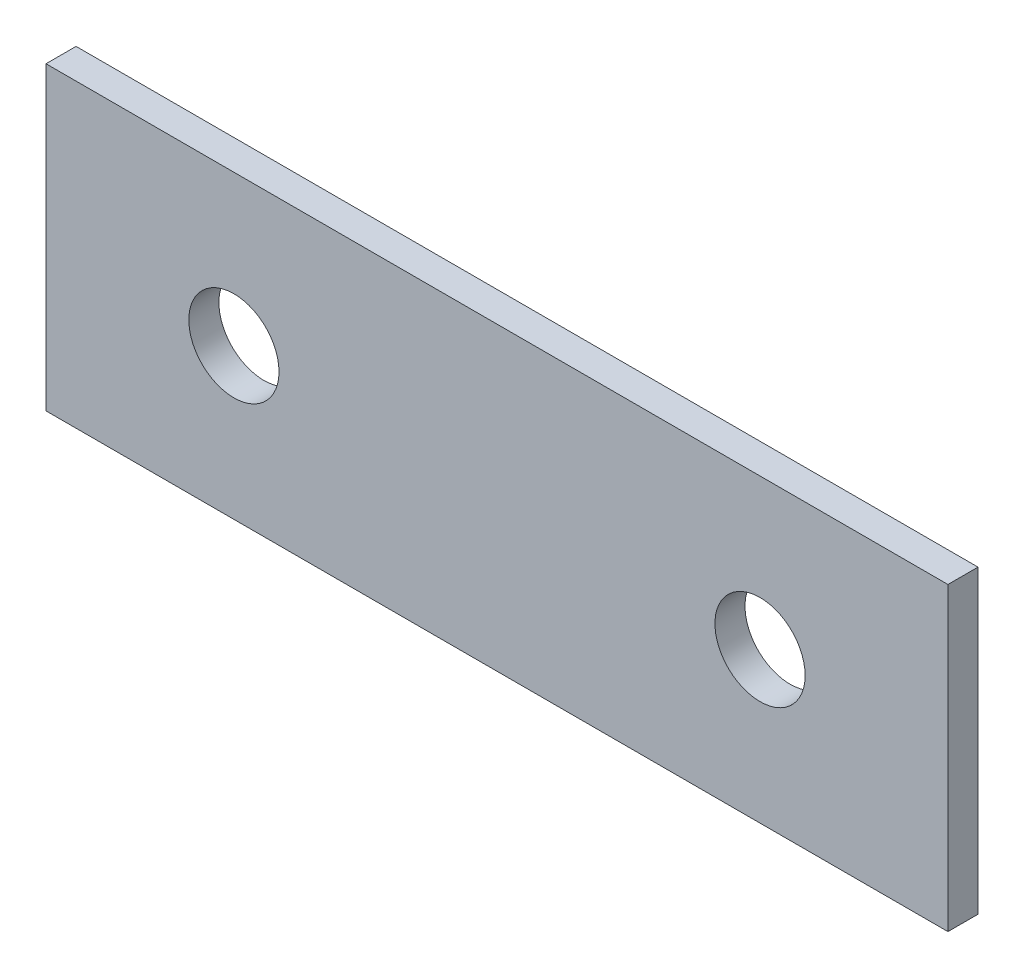
from build123d import *

# Parameters (mm, degrees)
ESBO_O1_W                = 30
ESBO_O1_H                = 10
ESBO_O1_R                = 1.5
RESSALTO_EXTRUS_O1_DEPTH = 1


with BuildPart() as part:
    # Esboço1 → Ressalto-extrusão1 (new body)
    with BuildSketch(Plane.XY):
        Rectangle(ESBO_O1_W, ESBO_O1_H)
        with Locations((-8.75, 0)):
            Circle(ESBO_O1_R, mode=Mode.SUBTRACT)
        with Locations((8.75, 0)):
            Circle(ESBO_O1_R, mode=Mode.SUBTRACT)
    extrude(amount=RESSALTO_EXTRUS_O1_DEPTH)


solid = part.part
